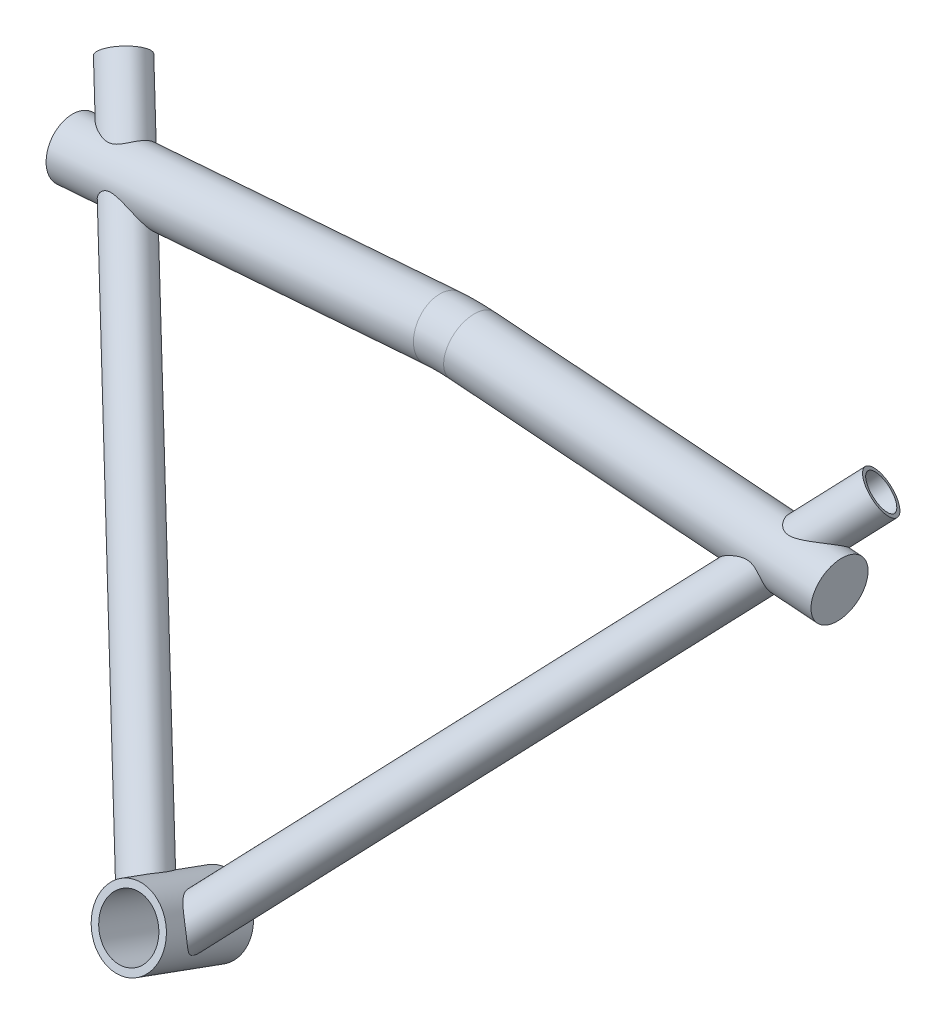
from build123d import *

# Parameters (mm, degrees)
SKETCH1_R               = 15.875
BOSS_EXTRUDE1_DEPTH     = 20.701
SWEEP1_PROFILE_R        = 9.525
SWEEP2_PROFILE_R        = 9.525
CUT_EXTRUDE2_REACH      = 434.387
SKETCH36_R              = 7.9375
CUT_EXTRUDE3_REACH      = 434.387
CUT_EXTRUDE3_END_RADIUS = 15.875
SKETCH37_R              = 7.9375
SKETCH77_R              = 15.875
BOSS_EXTRUDE2_DEPTH     = 41.402
CUT_EXTRUDE1_REACH      = 295.698
SKETCH2_R               = 12.7
SWEEP3_PROFILE_R        = 12.7


with BuildPart() as part:
    # Sketch1 → Boss-Extrude1 (new, symmetric)
    with BuildSketch(Plane(origin=(0, 0, 0), x_dir=(1, 0, 0), z_dir=(0, 0.34202014332566943, 0.9396926207859081))):
        with Locations(Location((0, 0, 0), (0, 0, 270))):
            Circle(SKETCH1_R)
    extrude(amount=BOSS_EXTRUDE1_DEPTH, both=True)

    # Sweep1: sweep along a path in Sketch4
    with BuildLine(Plane(origin=(0, 3.144101118, 3.616874596), x_dir=(1, 0, 0), z_dir=(0, 0.6560590289905084, 0.754709580222771))) as sweep1_path:
        Line((-5.08, -4.165974834), (-168.979466687, 229.906721821))
    # Sweep1 profile (on start of the path) → Sweep1 (sweep)
    with BuildSketch(Plane(origin=(-5.08, 0, 6.35), x_dir=(0.7330812283825074, 0.6801410975622588, 0), z_dir=(-0.5735764363510473, 0.6182218954839691, -0.5374120947718254))):
        Circle(SWEEP1_PROFILE_R)
    sweep(path=sweep1_path.line)

    # Sweep2: sweep along a path in Sketch15
    with BuildLine(Plane(origin=(0, 3.144101118, 3.616874596), x_dir=(1, 0, 0), z_dir=(0, 0.6560590289905084, 0.754709580222771))) as sweep2_path:
        Line((5.08, -4.165974834), (168.979466687, 229.906721821))
    # Sweep2 profile (on start of the path) → Sweep2 (sweep)
    with BuildSketch(Plane(origin=(5.08, 0, 6.35), x_dir=(0.7330812283825074, -0.6801410975622588, 0), z_dir=(0.5735764363510473, 0.6182218954839691, -0.5374120947718254))):
        Circle(SWEEP2_PROFILE_R)
    sweep(path=sweep2_path.line)

    # Sketch36 → Cut-Extrude2 (cut, up to next)
    with BuildSketch(Plane(origin=(-163.613367618, 176.348538477, -153.297445732), x_dir=(0.819110877584774, 0.4394391101382058, -0.36871484741361205), z_dir=(-0.5735764363510473, 0.6182218954839692, -0.5374120947718255)), mode=Mode.PRIVATE) as cut_extrude2_sk1:
        with Locations(Location((-6.502422539, -4.857839146, 0), (0, 0, 154.073467295))):
            Circle(SKETCH36_R)
    cut_extrude2_tool1 = extrude(cut_extrude2_sk1.sketch, amount=-CUT_EXTRUDE2_REACH, mode=Mode.PRIVATE) & part.part
    add(cut_extrude2_tool1.solids().sort_by_distance((-168.979467, 176.656907, -147.215506))[0], mode=Mode.SUBTRACT)

    # Cut-Extrude3: up to this cylinder (the profile starts outside it)
    cut_extrude3_end = Plane(origin=(0, -26.649219078, -73.218127664), z_dir=(0, -0.34202014332566943, -0.9396926207859081)) * Cylinder(CUT_EXTRUDE3_END_RADIUS, 901.524, mode=Mode.PRIVATE)
    # Sketch37 → Cut-Extrude3 (cut, up to the surface)
    with BuildSketch(Plane(origin=(163.613367618, 176.348538477, -153.297445732), x_dir=(0.8191108775847737, -0.4394391101382061, 0.36871484741361227), z_dir=(0.5735764363510476, 0.6182218954839689, -0.5374120947718255)), mode=Mode.PRIVATE) as cut_extrude3_sk1:
        with Locations(Location((6.502422539, -4.857839146, 0), (0, 0, 205.926532705))):
            Circle(SKETCH37_R)
    cut_extrude3_tool1 = extrude(cut_extrude3_sk1.sketch, amount=-CUT_EXTRUDE3_REACH, mode=Mode.PRIVATE) - cut_extrude3_end
    add(cut_extrude3_tool1.solids().sort_by_distance((168.979467, 176.656907, -147.215506))[0], mode=Mode.SUBTRACT)

    # Sketch77 → Boss-Extrude2 (add)
    with BuildSketch(Plane(origin=(0, 7.080158987, 19.452576943), x_dir=(1, 0, 0), z_dir=(0, 0.34202014332566943, 0.9396926207859082))):
        with Locations(Location((0, 0, 0), (0, 0, 270))):
            Circle(SKETCH77_R)
    extrude(amount=-BOSS_EXTRUDE2_DEPTH)

    # Sketch2 → Cut-Extrude1 (cut, up to next)
    with BuildSketch(Plane(origin=(0, -7.080158987, -19.452576943), x_dir=(-1, 0, 0), z_dir=(0, -0.34202014332566943, -0.9396926207859081)), mode=Mode.PRIVATE) as cut_extrude1_sk1:
        with Locations(Location((0, 0, 0), (0, 0, 90))):
            Circle(SKETCH2_R)
    cut_extrude1_tool1 = extrude(cut_extrude1_sk1.sketch, amount=-CUT_EXTRUDE1_REACH, mode=Mode.PRIVATE) & part.part
    add(cut_extrude1_tool1.solids().sort_by_distance((0, -7.080159, -19.452577))[0], mode=Mode.SUBTRACT)

    # Sweep3: sweep along a path in Sketch40
    with BuildLine(Plane(origin=(-106.934, 0, -127), x_dir=(1, 0, 0), z_dir=(0, 0, 1))) as sweep3_path:
        Line((-63.663829669, 149.860844852), (100.20235662, 162.304768472))
        ThreePointArc((100.20235662, 162.304768472), (106.934, 162.56), (113.66564338, 162.304768472))
        Line((113.66564338, 162.304768472), (277.531829669, 149.860844852))
    # Sweep3 profile (on start of the path) → Sweep3 (sweep)
    with BuildSketch(Plane(origin=(-170.597829669, 149.860844852, -127), x_dir=(-0.07572152283577545, 0.9971290041812199, 0), z_dir=(0.9971290041812199, 0.07572152283577545, 0))):
        Circle(SWEEP3_PROFILE_R)
    sweep(path=sweep3_path.line)


solid = part.part
